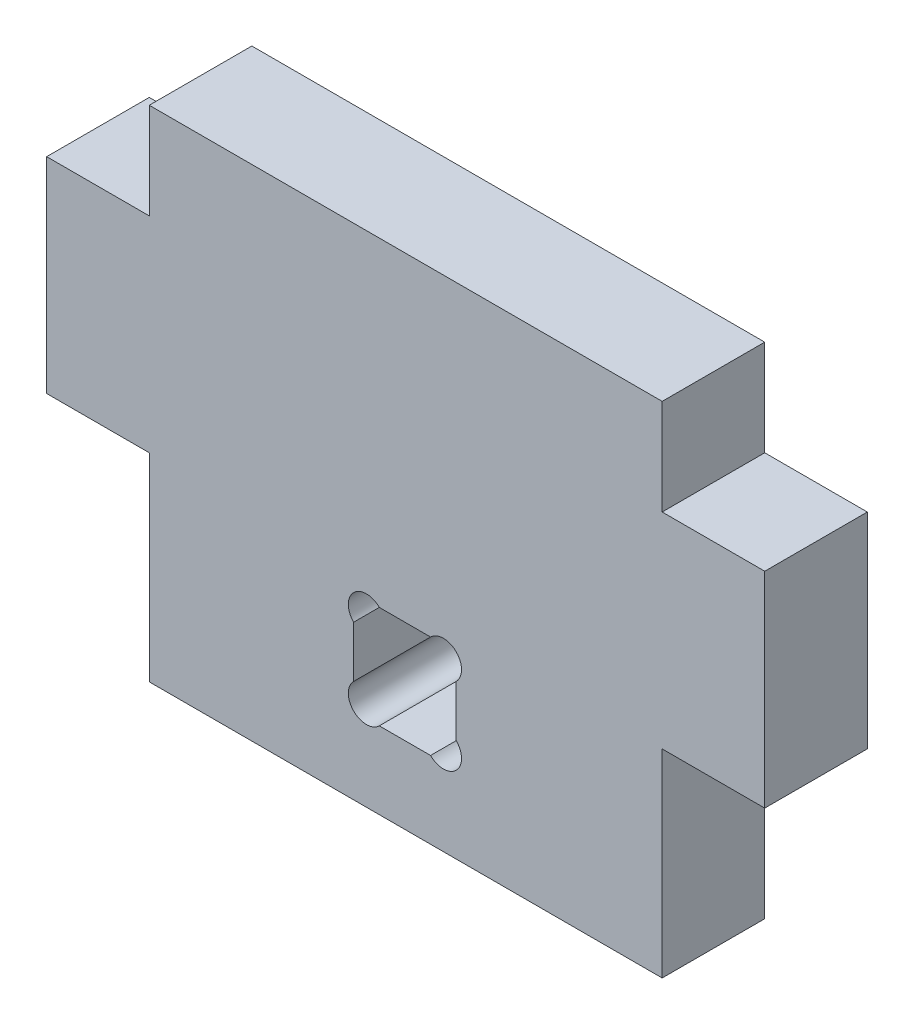
from build123d import *

# Parameters (mm, degrees)
BOSS_EXTRUDE1_DEPTH = 12.7
SKETCH2_R           = 2.24536
SKETCH2_W           = 12.7
SKETCH2_H           = 12.7
CUT_EXTRUDE1_DEPTH  = 57.115223473


with BuildPart() as part:
    # Sketch1 → Boss-Extrude1 (new body)
    with BuildSketch(Plane.XY):
        Polygon((-32.163183971, -6.040112022), (-32.163183971, -30.603981495), (31.336816029, -30.603981495), (31.336816029, -6.040112022), (44.036816029, -6.040112022), (44.036816029, 19.359887978), (31.336816029, 19.359887978), (31.336816029, 31.223757452), (-32.163183971, 31.223757452), (-32.163183971, 19.359887978), (-44.863183971, 19.359887978), (-44.863183971, -6.040112022), align=None)
    extrude(amount=BOSS_EXTRUDE1_DEPTH)

    # Sketch2 → Cut-Extrude1 (cut, through all)
    with BuildSketch(Plane.XY.offset(12.7)):
        with Locations((-5.273629901, -9.966481495)):
            Circle(SKETCH2_R)
        with Locations((-5.273629901, -19.491481495)):
            Circle(SKETCH2_R)
        with Locations((4.251370099, -19.491481495)):
            Circle(SKETCH2_R)
        with Locations((4.251370099, -9.966481495)):
            Circle(SKETCH2_R)
        with Locations((-0.511129901, -14.728981495)):
            Rectangle(SKETCH2_W, SKETCH2_H)
    extrude(amount=-CUT_EXTRUDE1_DEPTH, mode=Mode.SUBTRACT)


solid = part.part
